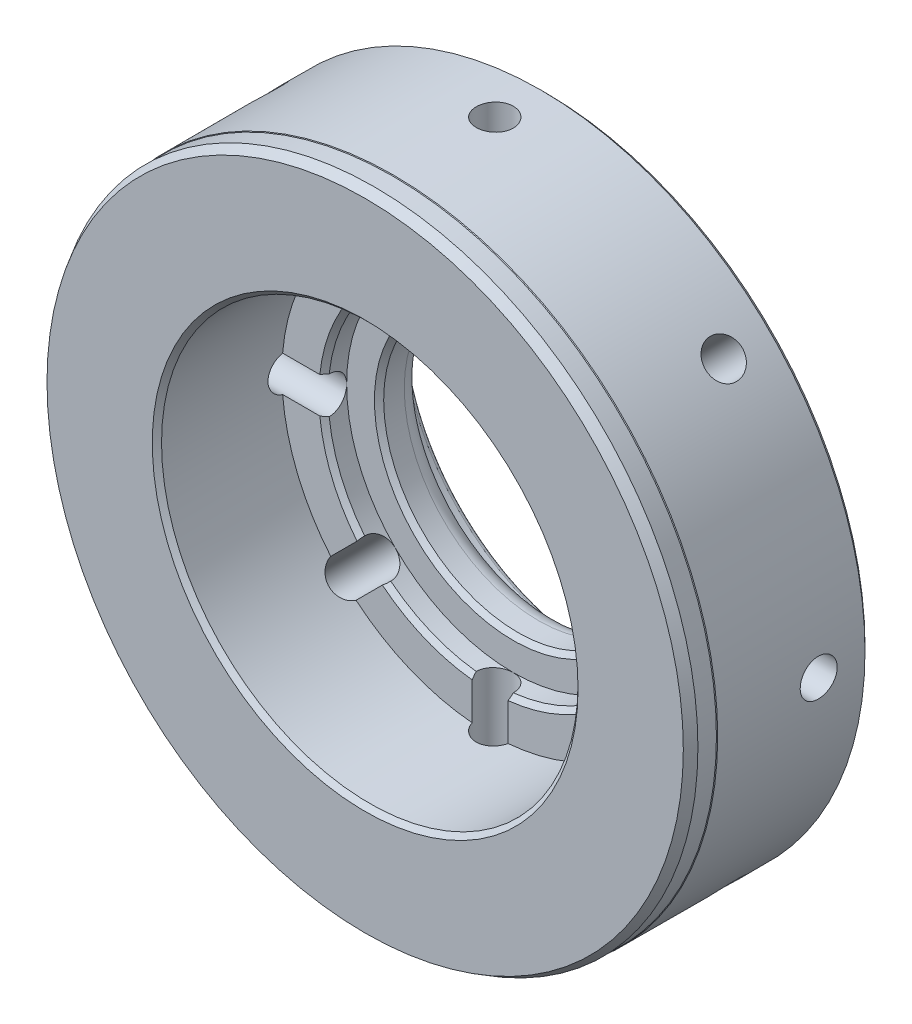
from build123d import *

# Parameters (mm, degrees)
CIRPATTERN1_COUNT = 8


with BuildPart() as part:
    # Sketch1 → Revolve1 (revolve)
    with BuildSketch(Plane(origin=(0, 0, 0), x_dir=(0, 0, -1), z_dir=(1, 0, 0)), mode=Mode.PRIVATE) as revolve1_sk:
        with BuildLine():
            Line((1, 34.95), (3, 34.95))
            Line((3, 34.95), (3.08660254, 35))
            Line((3.08660254, 35), (19, 35))
            Line((19, 35), (19.5, 34.5))
            Line((19.5, 34.5), (19.5, 26.5))
            Line((19.5, 26.5), (25, 26.5))
            Line((25, 26.5), (25.5, 26))
            Line((25.5, 26), (25.5, 21.5))
            ThreePointArc((25.5, 21.5), (25.353553391, 21.146446609), (25, 21))
            Line((25, 21), (22, 21))
            Line((22, 21), (20.655527926, 15.98236191))
            ThreePointArc((20.655527926, 15.98236191), (19.941199131, 14.913293319), (18.723676273, 14.5))
            Line((18.723676273, 14.5), (16.5, 14.5))
            Line((16.5, 14.5), (16, 15))
            Line((16, 15), (16, 18))
            Line((16, 18), (14, 18))
            Line((14, 18), (13.5, 18.5))
            Line((13.5, 18.5), (13.5, 22.5))
            Line((13.5, 22.5), (0.5, 22.5))
            Line((0.5, 22.5), (0, 23))
            Line((0, 23), (0, 34.372649731))
            Line((0, 34.372649731), (1, 34.95))
        make_face()
    revolve(revolve1_sk.sketch.rotate(Axis((0, 0, 0), (0, 0, -1)), 90), axis=Axis((0, 0, 0), (0, 0, -1)))

    # Sketch2 → Ø4.0 (4) Diameter Hole1 (revolve, cut)
    with BuildSketch(Plane(origin=(0, 35, -14), x_dir=(0, 0, 1), z_dir=(1, 0, 0))):
        Polygon((0, 0), (0, 26.201721238), (2, 25), (2, 0), align=None)
    f_4_0_4_diameter_hole1 = revolve(axis=Axis((0, 41.35, -14), (0, -1, 0)), mode=Mode.SUBTRACT)

    # CirPattern1: Ø4.0 (4) Diameter Hole1 ×8 about axis
    cirpattern1_axis = Axis((0, 0, 0), (0, 0, 1))
    for i in range(1, CIRPATTERN1_COUNT):
        add(f_4_0_4_diameter_hole1.rotate(cirpattern1_axis, i * 360 / CIRPATTERN1_COUNT), mode=Mode.SUBTRACT)


solid = part.part
